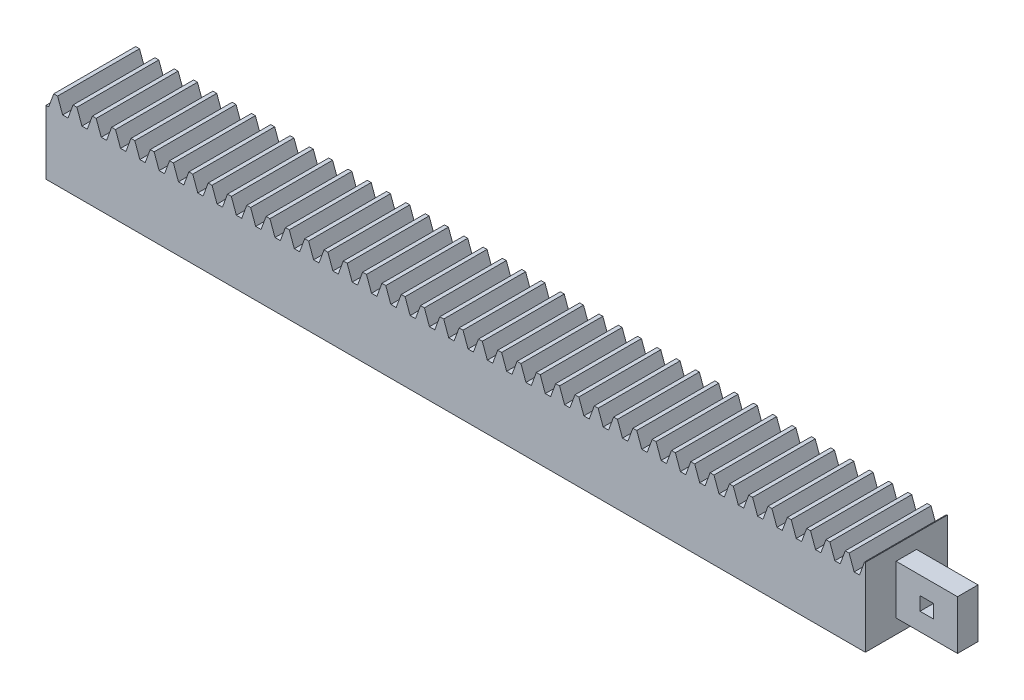
from build123d import *

# Parameters (mm, degrees)
BLANKSKE_W          = 200
BLANKSKE_H          = 19
BLANK_DEPTH         = 20
TOOTHCUTSIM_DEPTH   = 202.893536301
TEETHCUTS_COUNT     = 43
TEETHCUTS_PITCH     = 4.712388975
SKETCH1_W           = 5
SKETCH1_H           = 19
BOSS_EXTRUDE1_DEPTH = 15
SKETCH2_W           = 15
SKETCH2_H           = 3.5
SKETCH2_W_2         = 3.3
SKETCH2_H_2         = 3.3
CUT_EXTRUDE1_DEPTH  = 5


with BuildPart() as part:
    # BlankSke → Blank (new body)
    with BuildSketch(Plane.XY):
        with Locations((100, 9.5)):
            Rectangle(BLANKSKE_W, BLANKSKE_H)
    extrude(amount=-BLANK_DEPTH)

    # TooCutSkeSim → ToothCutSim (cut, through all)
    with BuildSketch(Plane.XY):
        Polygon((0.654653055, 15.625), (-0.654653055, 15.625), (-1.892297439, 19.0254), (1.892297439, 19.0254), align=None)
    toothcutsim = extrude(amount=-TOOTHCUTSIM_DEPTH, mode=Mode.SUBTRACT)

    # TeethCuts: ToothCutSim ×43
    with Locations(*[(i * TEETHCUTS_PITCH, 0, 0) for i in range(1, TEETHCUTS_COUNT)]):
        add(toothcutsim, mode=Mode.SUBTRACT)

    # Sketch1 → Boss-Extrude1 (add)
    with BuildSketch(Plane(origin=(200, 0, 0), x_dir=(0, 0, -1), z_dir=(1, 0, 0))):
        with Locations((10, 9.5)):
            Rectangle(SKETCH1_W, SKETCH1_H)
    extrude(amount=BOSS_EXTRUDE1_DEPTH)

    # Sketch2 → Cut-Extrude1 (cut)
    with BuildSketch(Plane(origin=(0, 0, -12.5), x_dir=(-1, 0, 0), z_dir=(0, 0, -1))):
        with Locations((-207.5, 17.25)):
            Rectangle(SKETCH2_W, SKETCH2_H)
        with Locations((-207.5, 1.75)):
            Rectangle(SKETCH2_W, SKETCH2_H)
        with Locations((-207.5, 9.5)):
            Rectangle(SKETCH2_W_2, SKETCH2_H_2)
    extrude(amount=-CUT_EXTRUDE1_DEPTH, mode=Mode.SUBTRACT)


solid = part.part
